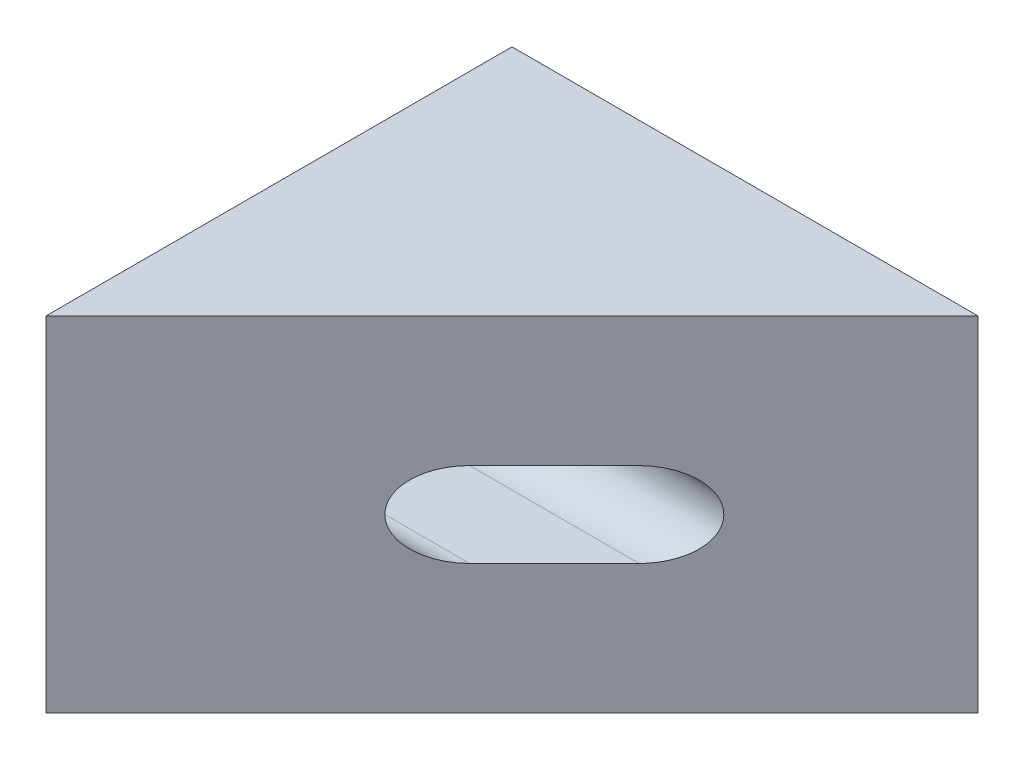
from build123d import *

# Parameters (mm, degrees)
BOSS_EXTRUDE1_DEPTH = 10.15
CUT_EXTRUDE1_DEPTH  = 20.3


with BuildPart() as part:
    # Sketch1 → Boss-Extrude1 (new, symmetric)
    with BuildSketch(Plane(origin=(0, 0, 0), x_dir=(1, 0, 0), z_dir=(0, 1, 0))):
        Polygon((0, 0), (0, -27.5), (27.5, 0), align=None)
    extrude(amount=BOSS_EXTRUDE1_DEPTH, both=True)

    # Sketch2 → Cut-Extrude1 (cut)
    with BuildSketch(Plane.ZY):
        with BuildLine():
            Line((15, -2.5), (10, -2.5))
            ThreePointArc((10, -2.5), (7.5, 0), (10, 2.5))
            Line((10, 2.5), (15, 2.5))
            ThreePointArc((15, 2.5), (17.5, 0), (15, -2.5))
        make_face()
    extrude(amount=-CUT_EXTRUDE1_DEPTH, mode=Mode.SUBTRACT)


solid = part.part
